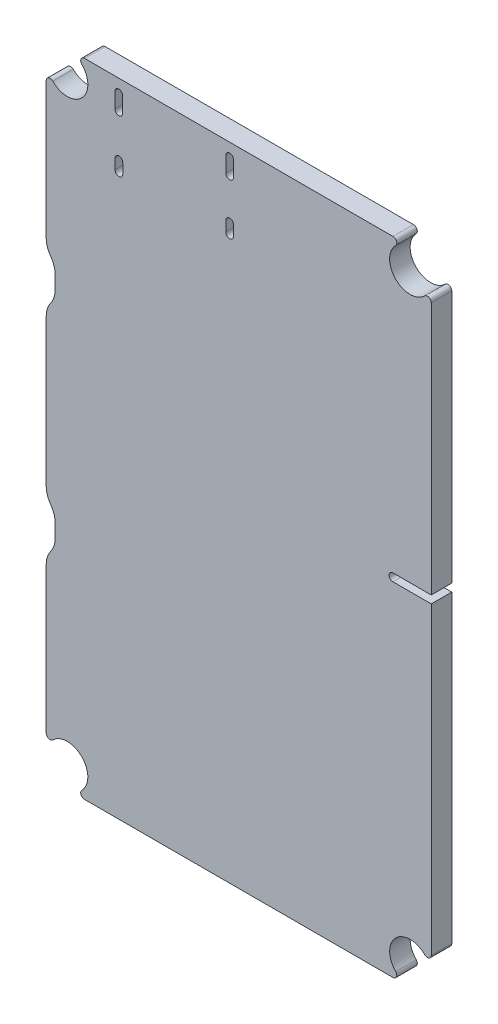
from build123d import *

# Parameters (mm, degrees)
BOARD_DEPTH        = 1.59936
CUT_EXTRUDE1_DEPTH = 73.128759538
CUT_EXTRUDE2_DEPTH = 73.128759538


with BuildPart() as part:
    # Sketch1 → Board (new body)
    with BuildSketch(Plane.XY):
        with BuildLine():
            Line((10, 12.987), (10, 24.35))
            ThreePointArc((10, 24.35), (10.089703362, 24.915270998), (10.35, 25.425))
            ThreePointArc((10.35, 25.425), (10.610296638, 25.934729002), (10.7, 26.5))
            Line((10.7, 26.5), (10.7, 27.5))
            ThreePointArc((10.7, 27.5), (10.610296638, 28.065270998), (10.35, 28.575))
            ThreePointArc((10.35, 28.575), (10.089703362, 29.084729002), (10, 29.65))
            Line((10, 29.65), (10, 41.1))
            ThreePointArc((10, 41.1), (10.089703362, 41.665270998), (10.35, 42.175))
            ThreePointArc((10.35, 42.175), (10.610296638, 42.684729002), (10.7, 43.25))
            Line((10.7, 43.25), (10.7, 44.25))
            ThreePointArc((10.7, 44.25), (10.610296638, 44.815270998), (10.35, 45.325))
            ThreePointArc((10.35, 45.325), (10.089703362, 45.834729002), (10, 46.4))
            Line((10, 46.4), (10, 57.01299))
            ThreePointArc((10, 57.01299), (10.185195521, 57.290150019), (10.51213, 57.22512))
            ThreePointArc((10.51213, 57.22512), (12.776257609, 57.223732391), (12.77487, 59.48786))
            ThreePointArc((12.77487, 59.48786), (12.709829188, 59.814802566), (12.987, 60))
            Line((12.987, 60), (37.01299, 60))
            ThreePointArc((37.01299, 60), (37.290150019, 59.814804479), (37.22512, 59.48787))
            ThreePointArc((37.22512, 59.48787), (37.223732391, 57.223742391), (39.48786, 57.22513))
            ThreePointArc((39.48786, 57.22513), (39.814807186, 57.290168899), (40, 57.01299))
            Line((40, 57.01299), (40, 12.987))
            ThreePointArc((40, 12.987), (39.814804479, 12.709839981), (39.48787, 12.77487))
            ThreePointArc((39.48787, 12.77487), (37.226515909, 12.773484091), (37.22513, 10.51213))
            ThreePointArc((37.22513, 10.51213), (37.290158106, 10.185190901), (37.01299, 10))
            Line((37.01299, 10), (12.987, 10))
            ThreePointArc((12.987, 10), (12.709839981, 10.185195521), (12.77487, 10.51213))
            ThreePointArc((12.77487, 10.51213), (12.773484091, 12.773484091), (10.51213, 12.77487))
            ThreePointArc((10.51213, 12.77487), (10.185195521, 12.709839981), (10, 12.987))
        make_face()
    extrude(amount=BOARD_DEPTH)

    # Sketch2 → Cut-Extrude1 (cut, through all)
    with BuildSketch(Plane.XY.offset(1.59936)):
        with BuildLine():
            Line((15.956, 58.964), (15.956, 57.764))
            ThreePointArc((15.956, 57.764), (15.656, 57.464), (15.356, 57.764))
            Line((15.356, 57.764), (15.356, 58.964))
            ThreePointArc((15.356, 58.964), (15.656, 59.264), (15.956, 58.964))
        make_face()
        with BuildLine():
            Line((15.96453, 54.46518), (15.96453, 53.66518))
            ThreePointArc((15.96453, 53.66518), (15.66453, 53.36518), (15.36453, 53.66518))
            Line((15.36453, 53.66518), (15.36453, 54.46518))
            ThreePointArc((15.36453, 54.46518), (15.66453, 54.76518), (15.96453, 54.46518))
        make_face()
        with BuildLine():
            Line((24.592, 54.584), (24.592, 53.784))
            ThreePointArc((24.592, 53.784), (24.292, 53.484), (23.992, 53.784))
            Line((23.992, 53.784), (23.992, 54.584))
            ThreePointArc((23.992, 54.584), (24.292, 54.884), (24.592, 54.584))
        make_face()
        with BuildLine():
            Line((24.592, 58.964), (24.592, 57.764))
            ThreePointArc((24.592, 57.764), (24.292, 57.464), (23.992, 57.764))
            Line((23.992, 57.764), (23.992, 58.964))
            ThreePointArc((23.992, 58.964), (24.292, 59.264), (24.592, 58.964))
        make_face()
    extrude(amount=-CUT_EXTRUDE1_DEPTH, mode=Mode.SUBTRACT)

    # Sketch3 → Cut-Extrude2 (cut, through all)
    with BuildSketch(Plane.XY.offset(1.59936)):
        with BuildLine():
            Line((37.015, 37.3), (41.715, 37.3))
            Line((41.715, 37.3), (41.715, 36.7))
            Line((41.715, 36.7), (37.015, 36.7))
            ThreePointArc((37.015, 36.7), (36.714999967, 37), (37.015, 37.3))
        make_face()
    extrude(amount=-CUT_EXTRUDE2_DEPTH, mode=Mode.SUBTRACT)


solid = part.part
